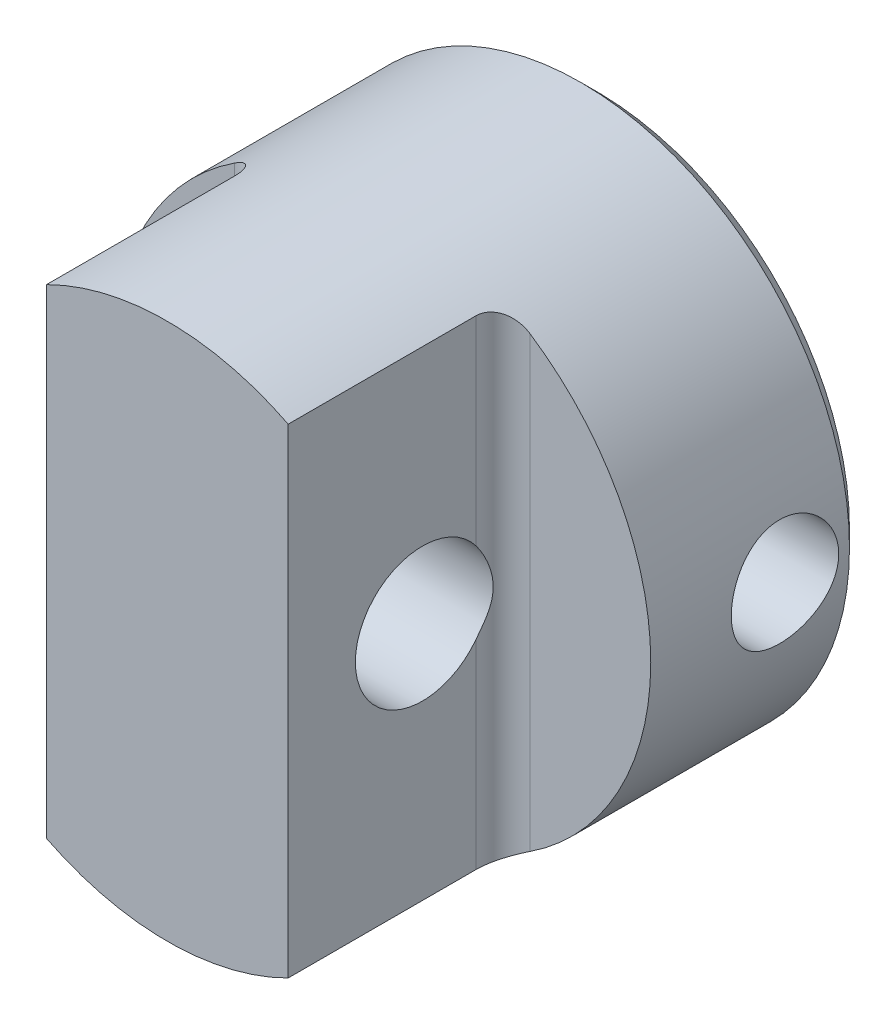
from build123d import *

# Parameters (mm, degrees)
SKETCH_1_R               = 50
EXTRUDE_1_DEPTH          = 80
CUT_EXTRUDE_START        = -40
CUT_EXTRUDE_1_DEPTH      = 40
FILLET_1_R               = 5
CUT_EXTRUDE_2_DEPTH      = 107.770782689
CUT_EXTRUDE_2_DEPTH_BACK = 107.770782689
SKETCH_3_R               = 12.5
CHAMFER_1_SIZE           = 3
CUT_EXTRUDE_3_DEPTH      = 107.770782689
CUT_EXTRUDE_3_DEPTH_BACK = 107.770782689
SKETCH_4_R               = 10


with BuildPart() as part:
    # Эскиз1 → Бобышка-Вытянуть1 (new body)
    with BuildSketch(Plane.XY):
        Circle(SKETCH_1_R)
    extrude(amount=EXTRUDE_1_DEPTH)

    # Эскиз2 → Вырез-Вытянуть1 (cut)
    with BuildSketch(Plane.XY.offset(80).offset(CUT_EXTRUDE_START)):
        with BuildLine():
            Line((-22.5, 44.651427749), (-22.5, -44.651427749))
            ThreePointArc((-22.5, -44.651427749), (-50, 0), (-22.5, 44.651427749))
        make_face()
        with BuildLine():
            Line((22.5, 44.651427749), (22.5, -44.651427749))
            ThreePointArc((22.5, -44.651427749), (50, 0), (22.5, 44.651427749))
        make_face()
    extrude(amount=CUT_EXTRUDE_1_DEPTH, mode=Mode.SUBTRACT)

    # Скругление1
    fillet_1_edges = [part.edges().sort_by_distance(p)[0] for p in [
        (22.5, 0, 40),
        (-22.5, 0, 40),
    ]]
    fillet(fillet_1_edges, radius=FILLET_1_R)

    # Эскиз3 → Вырез-Вытянуть2 (cut, two sides: drawn at the far end of the back side and taken through both)
    with BuildSketch(Plane(origin=(0, 0, 0), x_dir=(0, 0, -1), z_dir=(1, 0, 0)).offset(-CUT_EXTRUDE_2_DEPTH_BACK)):
        with Locations(Location((-55, 0, 0), (0, 0, 36.869897646))):
            Circle(SKETCH_3_R)
    extrude(amount=CUT_EXTRUDE_2_DEPTH + CUT_EXTRUDE_2_DEPTH_BACK, mode=Mode.SUBTRACT)

    # Фаска1
    chamfer_1_edges = [part.edges().sort_by_distance(p)[0] for p in [
        (-50, 0, 0),
    ]]
    chamfer(chamfer_1_edges, length=CHAMFER_1_SIZE)

    # Эскиз4 → Вырез-Вытянуть3 (cut, two sides: drawn at the far end of the back side and taken through both)
    with BuildSketch(Plane(origin=(0, 0, 0), x_dir=(0, 0, -1), z_dir=(1, 0, 0)).offset(-CUT_EXTRUDE_3_DEPTH_BACK)):
        with Locations((-15, 0)):
            Circle(SKETCH_4_R)
    extrude(amount=CUT_EXTRUDE_3_DEPTH + CUT_EXTRUDE_3_DEPTH_BACK, mode=Mode.SUBTRACT)


solid = part.part
